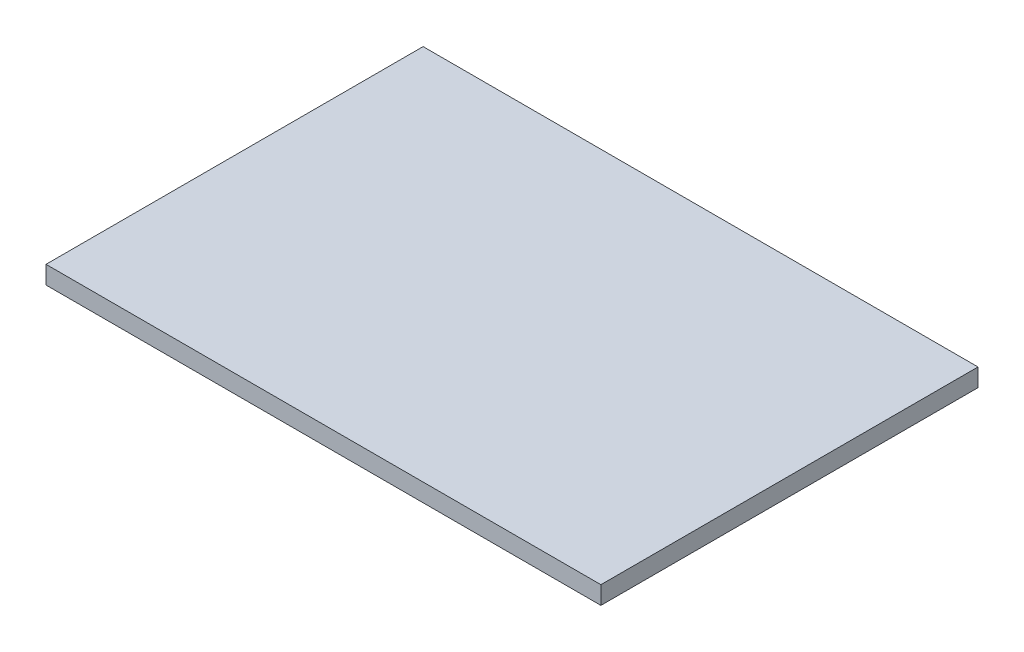
from build123d import *

# Parameters (mm, degrees)
SKETCH1_W           = 309
SKETCH1_H           = 210
BOSS_EXTRUDE1_DEPTH = 10


with BuildPart() as part:
    # Sketch1 → Boss-Extrude1 (new body)
    with BuildSketch(Plane(origin=(0, 0, 0), x_dir=(1, 0, 0), z_dir=(0, 1, 0))):
        with Locations((154.5, 105)):
            Rectangle(SKETCH1_W, SKETCH1_H)
    extrude(amount=BOSS_EXTRUDE1_DEPTH)


solid = part.part
